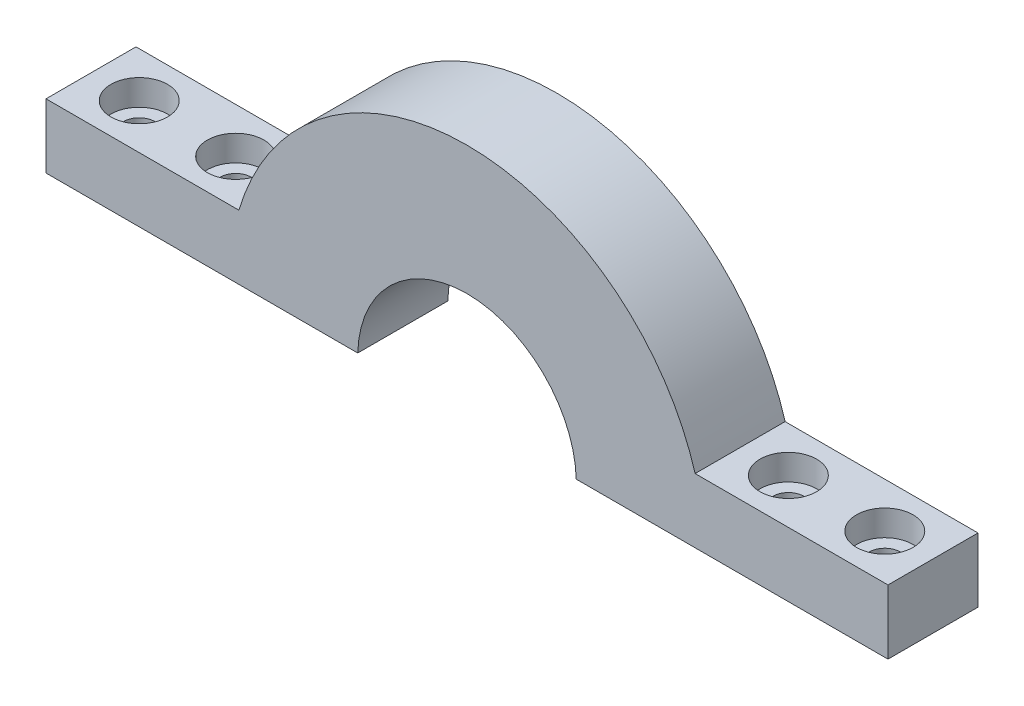
from build123d import *

# Parameters (mm, degrees)
BOSS_EXTRUDE1_DEPTH            = 7
CBORE_FOR_M2_SHCS1_D           = 2.4
CBORE_FOR_M2_SHCS1_CBORE_D     = 4.4
CBORE_FOR_M2_SHCS1_CBORE_DEPTH = 2


with BuildPart() as part:
    # Sketch1 → Boss-Extrude1 (new body)
    with BuildSketch(Plane.XY):
        with BuildLine():
            Line((-18.498310734, 0.25), (-32.739433475, 0.25))
            Line((-32.739433475, 0.25), (-32.739433475, 5.25))
            Line((-32.739433475, 5.25), (-17.739433475, 5.25))
            ThreePointArc((-17.739433475, 5.25), (0, 18.5), (17.739433475, 5.25))
            Line((17.739433475, 5.25), (32.739433475, 5.25))
            Line((32.739433475, 5.25), (32.739433475, 0.25))
            Line((32.739433475, 0.25), (18.498310734, 0.25))
            Line((18.498310734, 0.25), (8.496322734, 0.25))
            ThreePointArc((8.496322734, 0.25), (0, 8.5), (-8.496322734, 0.25))
            Line((-8.496322734, 0.25), (-18.498310734, 0.25))
        make_face()
    extrude(amount=-BOSS_EXTRUDE1_DEPTH)

    # CBORE for M2 SHCS1 (through all)
    with Locations(Plane(origin=(0, 5.25, 0), x_dir=(1, 0, 0), z_dir=(0, 1, 0))):
        with Locations((28.989433475, 3.5), (-28.989433475, 3.5), (-21.489433475, 3.5), (21.489433475, 3.5)):
            CounterBoreHole(CBORE_FOR_M2_SHCS1_D / 2, CBORE_FOR_M2_SHCS1_CBORE_D / 2, CBORE_FOR_M2_SHCS1_CBORE_DEPTH)


solid = part.part
